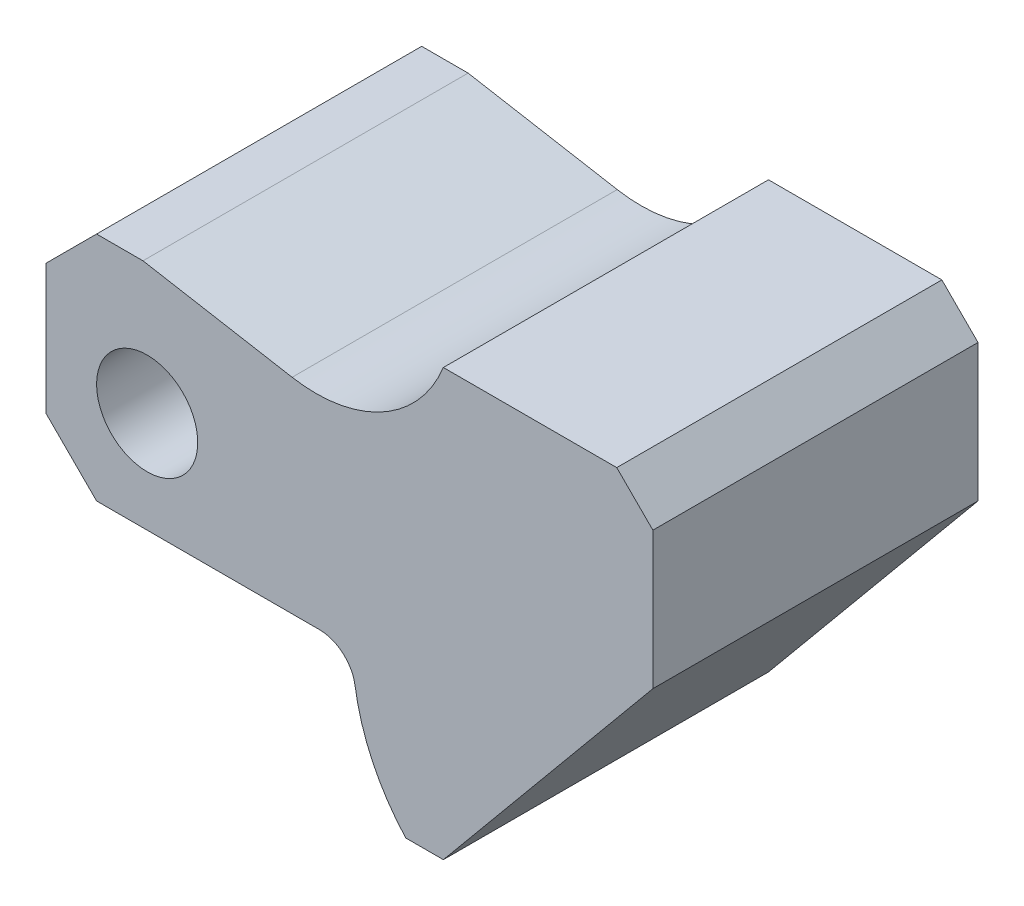
from build123d import *

# Parameters (mm, degrees)
SKETCH1_R           = 7
BOSS_EXTRUDE1_DEPTH = 45


with BuildPart() as part:
    # Sketch1 → Boss-Extrude1 (new body)
    with BuildSketch(Plane.XY):
        with BuildLine():
            Line((0, 0), (-7, 7))
            Line((-7, 7), (-7, 25))
            Line((-7, 25), (0, 32))
            Line((0, 32), (6.423127039, 32))
            Line((6.423127039, 32), (27.065669866, 28.360162749))
            ThreePointArc((27.065669866, 28.360162749), (39.598052013, 30.465773758), (48, 40))
            Line((48, 40), (72, 40))
            Line((72, 40), (77, 35))
            Line((77, 35), (77, 16))
            Line((77, 16), (48, -19))
            Line((48, -19), (42.788067397, -19))
            ThreePointArc((42.788067397, -19), (38.195084944, -12.141439328), (35.777704557, -4.248935646))
            ThreePointArc((35.777704557, -4.248935646), (34.093629186, -1.208211387), (30.83443617, 0))
            Line((30.83443617, 0), (0, 0))
        make_face()
        with Locations(Location((7, 14, 0), (0, 0, 180))):
            Circle(SKETCH1_R, mode=Mode.SUBTRACT)
    extrude(amount=BOSS_EXTRUDE1_DEPTH)


solid = part.part
